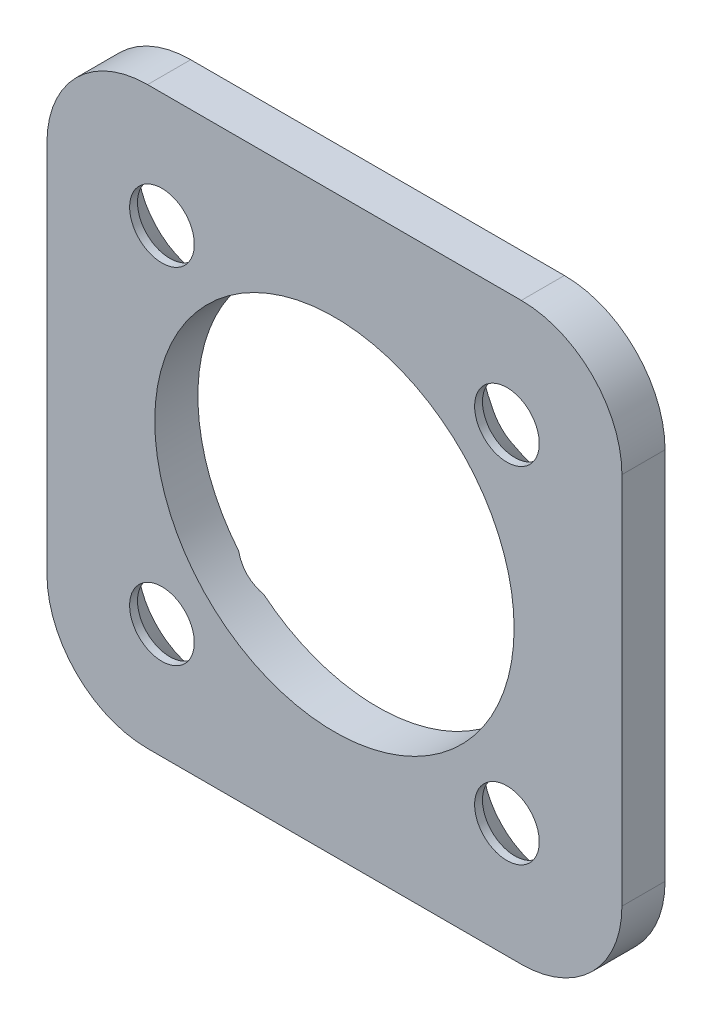
from build123d import *

# Parameters (mm, degrees)
SKETCH1_W                                    = 40
SKETCH1_H                                    = 40
SKETCH1_R                                    = 12.5
BOSS_EXTRUDE1_DEPTH                          = 3
FILLET1_R                                    = 7
CSK_FOR_M4_COUNTERSUNK_FLAT_HEAD_SCR_2_COUNT = 2
CSK_FOR_M4_COUNTERSUNK_FLAT_HEAD_SCR_2_PITCH = 24
CSK_FOR_M4_COUNTERSUNK_FLAT_HEAD_SCR_3_COUNT = 2
CSK_FOR_M4_COUNTERSUNK_FLAT_HEAD_SCR_3_PITCH = 33.941125497
CSK_FOR_M4_COUNTERSUNK_FLAT_HEAD_SCR_4_COUNT = 2
CSK_FOR_M4_COUNTERSUNK_FLAT_HEAD_SCR_4_PITCH = 24


with BuildPart() as part:
    # Sketch1 → Boss-Extrude1 (new body)
    with BuildSketch(Plane.XY):
        Rectangle(SKETCH1_W, SKETCH1_H)
        Circle(SKETCH1_R, mode=Mode.SUBTRACT)
    extrude(amount=BOSS_EXTRUDE1_DEPTH)

    # Fillet1
    fillet1_edges = [part.edges().sort_by_distance(p)[0] for p in [
        (-20, -20, 1.5),
        (-20, 20, 1.5),
        (20, 20, 1.5),
        (20, -20, 1.5),
    ]]
    fillet(fillet1_edges, radius=FILLET1_R)

    # Sketch3 → CSK for M4 Countersunk Flat Head Screw1 (revolve, cut)
    with BuildSketch(Plane(origin=(12, 12, 0), x_dir=(0, 1, 0), z_dir=(1, 0, 0))):
        Polygon((0, 0), (0, 3), (2.25, 3), (2.25, 2.45), (4.7, 0), align=None)
    csk_for_m4_countersunk_flat_head_screw1 = revolve(axis=Axis((12, 12, -6.35), (0, 0, 1)), mode=Mode.SUBTRACT)

    # CSK for M4 Countersunk Flat Head Scr 2: CSK for M4 Countersunk Flat Head Screw1 ×2
    with Locations(*[(-i * CSK_FOR_M4_COUNTERSUNK_FLAT_HEAD_SCR_2_PITCH, 0, 0) for i in range(1, CSK_FOR_M4_COUNTERSUNK_FLAT_HEAD_SCR_2_COUNT)]):
        add(csk_for_m4_countersunk_flat_head_screw1, mode=Mode.SUBTRACT)

    # CSK for M4 Countersunk Flat Head Scr 3: CSK for M4 Countersunk Flat Head Screw1 ×2
    with Locations(*[Vector(-0.7071067811865475, -0.7071067811865476, 0) * (i * CSK_FOR_M4_COUNTERSUNK_FLAT_HEAD_SCR_3_PITCH) for i in range(1, CSK_FOR_M4_COUNTERSUNK_FLAT_HEAD_SCR_3_COUNT)]):
        add(csk_for_m4_countersunk_flat_head_screw1, mode=Mode.SUBTRACT)

    # CSK for M4 Countersunk Flat Head Scr 4: CSK for M4 Countersunk Flat Head Screw1 ×2
    with Locations(*[(0, -i * CSK_FOR_M4_COUNTERSUNK_FLAT_HEAD_SCR_4_PITCH, 0) for i in range(1, CSK_FOR_M4_COUNTERSUNK_FLAT_HEAD_SCR_4_COUNT)]):
        add(csk_for_m4_countersunk_flat_head_screw1, mode=Mode.SUBTRACT)


solid = part.part
